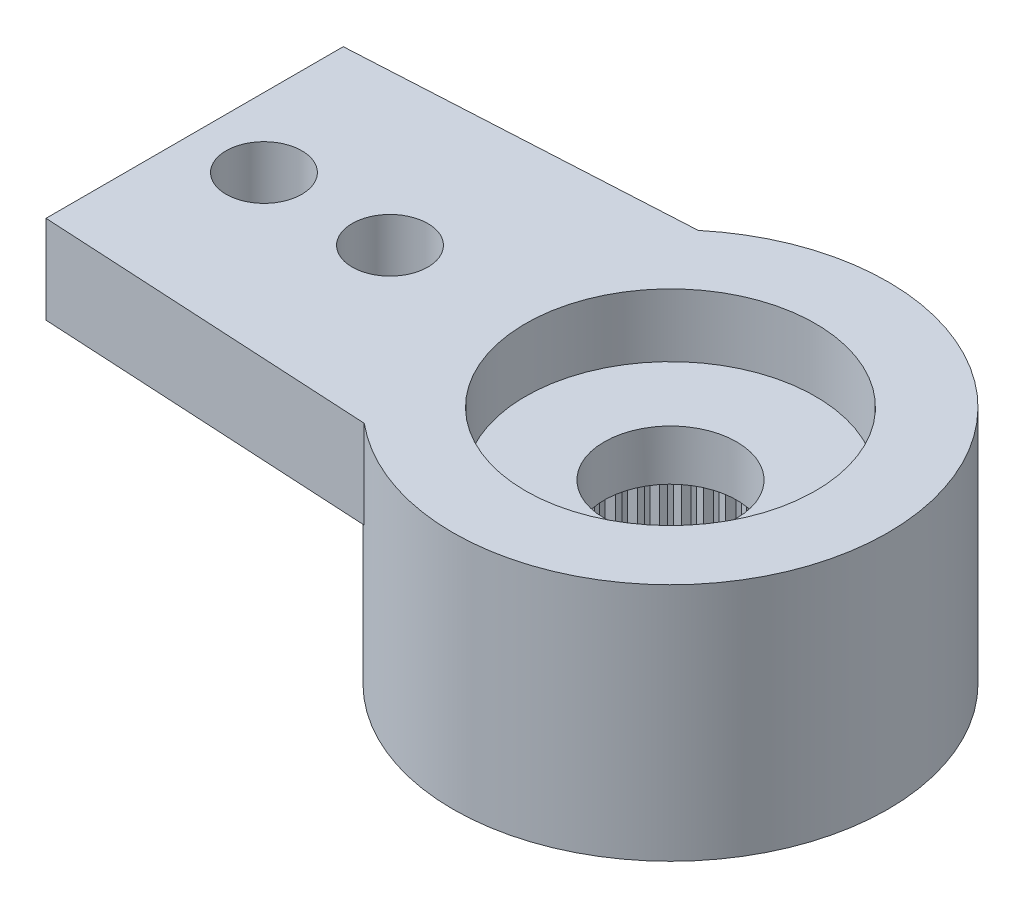
from build123d import *

# Parameters (mm, degrees)
RESSALTO_EXTRUS_O1_DEPTH = 1.4
ESBO_O2_R                = 3.45
RESSALTO_EXTRUS_O2_DEPTH = 2.4
FURO4_D                  = 1.2
PADR_O_LINEAR1_COUNT     = 6
PADR_O_LINEAR1_PITCH     = 2
FURO1_D                  = 4.95
FURO1_DEPTH              = 2
FURO2_D                  = 4.6
FURO2_DEPTH              = 1
FURO3_D                  = 2.1
RESSALTO_EXTRUS_O3_START = -2
RESSALTO_EXTRUS_O3_DEPTH = 2
PADR_OCIRCULAR1_COUNT    = 60
SKETCH1_W                = 17
SKETCH1_H                = 7.269489176
CUT_EXTRUDE1_DEPTH       = 10


with BuildPart() as part:
    # Esboço1 → Ressalto-extrusão1 (new body)
    with BuildSketch(Plane(origin=(0, 0, 0), x_dir=(1, 0, 0), z_dir=(0, 1, 0))):
        with BuildLine():
            Line((-14.159121967, 1.99702088), (-2.209072203, 2.65))
            ThreePointArc((-2.209072203, 2.65), (3.45, 0), (-2.209072203, -2.65))
            Line((-2.209072203, -2.65), (-14.159121967, -1.99702088))
            ThreePointArc((-14.159121967, -1.99702088), (-16.05, 0), (-14.159121967, 1.99702088))
        make_face()
    extrude(amount=-RESSALTO_EXTRUS_O1_DEPTH)

    # Esboço2 → Ressalto-extrusão2 (add)
    with BuildSketch(Plane.XZ.offset(1.4)):
        with Locations(Location((0, 0, 0), (0, 0, 90))):
            Circle(ESBO_O2_R)
    extrude(amount=RESSALTO_EXTRUS_O2_DEPTH)

    # Furo4 (through all)
    with Locations(Plane(origin=(0, 0, 0), x_dir=(1, 0, 0), z_dir=(0, 1, 0))):
        with Locations((-14.45, 0)):
            furo4 = Hole(FURO4_D / 2)

    # Padrão linear1: Furo4 ×6
    with Locations(*[(i * PADR_O_LINEAR1_PITCH, 0, 0) for i in range(1, PADR_O_LINEAR1_COUNT)]):
        add(furo4, mode=Mode.SUBTRACT)

    # Furo1
    with Locations(Plane(origin=(0, -3.8, 0), x_dir=(-1, 0, 0), z_dir=(0, -1, 0))):
        with Locations((0, 0)):
            Hole(FURO1_D / 2, depth=FURO1_DEPTH)

    # Furo2
    with Locations(Plane(origin=(0, 0, 0), x_dir=(1, 0, 0), z_dir=(0, 1, 0))):
        with Locations((0, 0)):
            Hole(FURO2_D / 2, depth=FURO2_DEPTH)

    # Furo3 (through all)
    with Locations(Plane(origin=(0, 0, 0), x_dir=(1, 0, 0), z_dir=(0, 1, 0))):
        with Locations((0, 0)):
            Hole(FURO3_D / 2)

    # Esboço11 → Ressalto-extrusão3 (add)
    with BuildSketch(Plane.XZ.offset(3.8).offset(RESSALTO_EXTRUS_O3_START)):
        with BuildLine():
            Line((-0.098056786, 2.473056786), (0, 2.375))
            Line((0, 2.375), (0.098056786, 2.473056786))
            ThreePointArc((0.098056786, 2.473056786), (0, 2.475), (-0.098056786, 2.473056786))
        make_face()
    ressalto_extrus_o3 = extrude(amount=RESSALTO_EXTRUS_O3_DEPTH)

    # PadrãoCircular1: Ressalto-extrusão3 ×60 about axis
    padr_ocircular1_axis = Axis((0, 0, 0), (0, 1, 0))
    for i in range(1, PADR_OCIRCULAR1_COUNT):
        add(ressalto_extrus_o3.rotate(padr_ocircular1_axis, i * 360 / PADR_OCIRCULAR1_COUNT))

    # Sketch1 → Cut-Extrude1 (cut)
    with BuildSketch(Plane(origin=(0, 0, 0), x_dir=(1, 0, 0), z_dir=(0, 1, 0))):
        with Locations((-16.05, 0)):
            Rectangle(SKETCH1_W, SKETCH1_H)
    extrude(amount=-CUT_EXTRUDE1_DEPTH, mode=Mode.SUBTRACT)


solid = part.part
